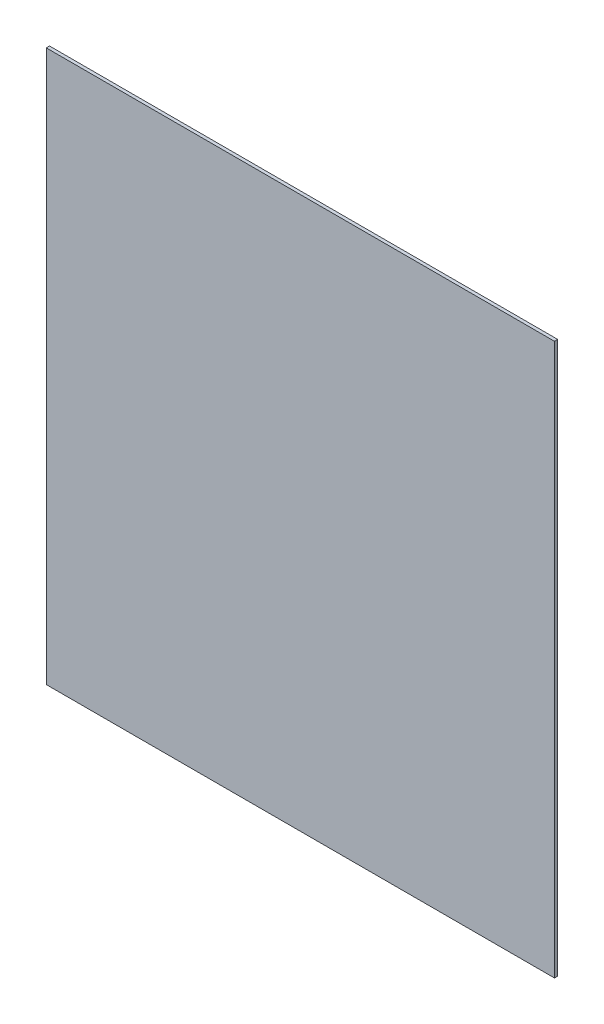
from build123d import *

# Parameters (mm, degrees)
SKETCH1_W           = 470
SKETCH1_H           = 510
BOSS_EXTRUDE1_DEPTH = 3


with BuildPart() as part:
    # Sketch1 → Boss-Extrude1 (new body)
    with BuildSketch(Plane.XY):
        Rectangle(SKETCH1_W, SKETCH1_H)
    extrude(amount=BOSS_EXTRUDE1_DEPTH)


solid = part.part
